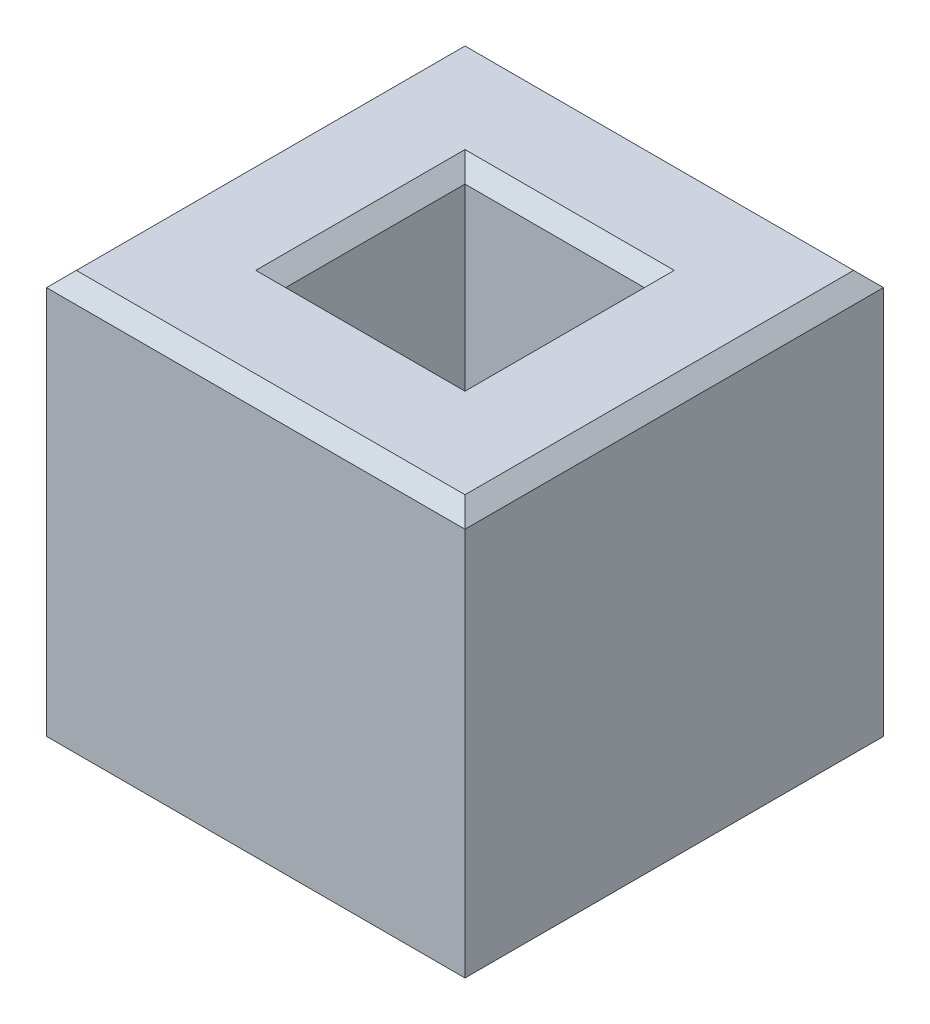
from build123d import *

# Parameters (mm, degrees)
SKETCH2_W               = 177.8
SKETCH2_H               = 177.8
BOSS_EXTRUDE1_DEPTH     = 177.8
CUT_EXTRUDE1_DEPTH      = 218.759638133
CUT_EXTRUDE1_DEPTH_BACK = 218.759638133
SKETCH3_W               = 76.2
SKETCH3_H               = 76.2
CHAMFER1_SIZE           = 6.35


with BuildPart() as part:
    # Sketch2 → Boss-Extrude1 (new body)
    with BuildSketch(Plane(origin=(0, 0, 0), x_dir=(1, 0, 0), z_dir=(0, 1, 0))):
        Rectangle(SKETCH2_W, SKETCH2_H)
    extrude(amount=BOSS_EXTRUDE1_DEPTH)

    # Sketch3 → Cut-Extrude1 (cut, two sides: drawn at the far end of the back side and taken through both)
    with BuildSketch(Plane(origin=(0, 177.8, 0), x_dir=(1, 0, 0), z_dir=(0, 1, 0)).offset(-CUT_EXTRUDE1_DEPTH_BACK)):
        Rectangle(SKETCH3_W, SKETCH3_H)
    extrude(amount=CUT_EXTRUDE1_DEPTH + CUT_EXTRUDE1_DEPTH_BACK, mode=Mode.SUBTRACT)

    # Chamfer1
    chamfer1_edges = [part.edges().sort_by_distance(p)[0] for p in [
        (-88.9, 177.8, 0),
        (0, 177.8, 88.9),
        (38.1, 177.8, 0),
        (38.1, 0, 0),
        (0, 177.8, 38.1),
        (0, 0, 38.1),
        (-38.1, 177.8, 0),
        (-38.1, 0, 0),
        (0, 177.8, -38.1),
        (0, 0, -38.1),
        (88.9, 177.8, 0),
        (0, 0, 88.9),
        (-88.9, 0, 0),
        (0, 0, -88.9),
        (88.9, 0, 0),
        (0, 177.8, -88.9),
    ]]
    chamfer(chamfer1_edges, length=CHAMFER1_SIZE)


solid = part.part
